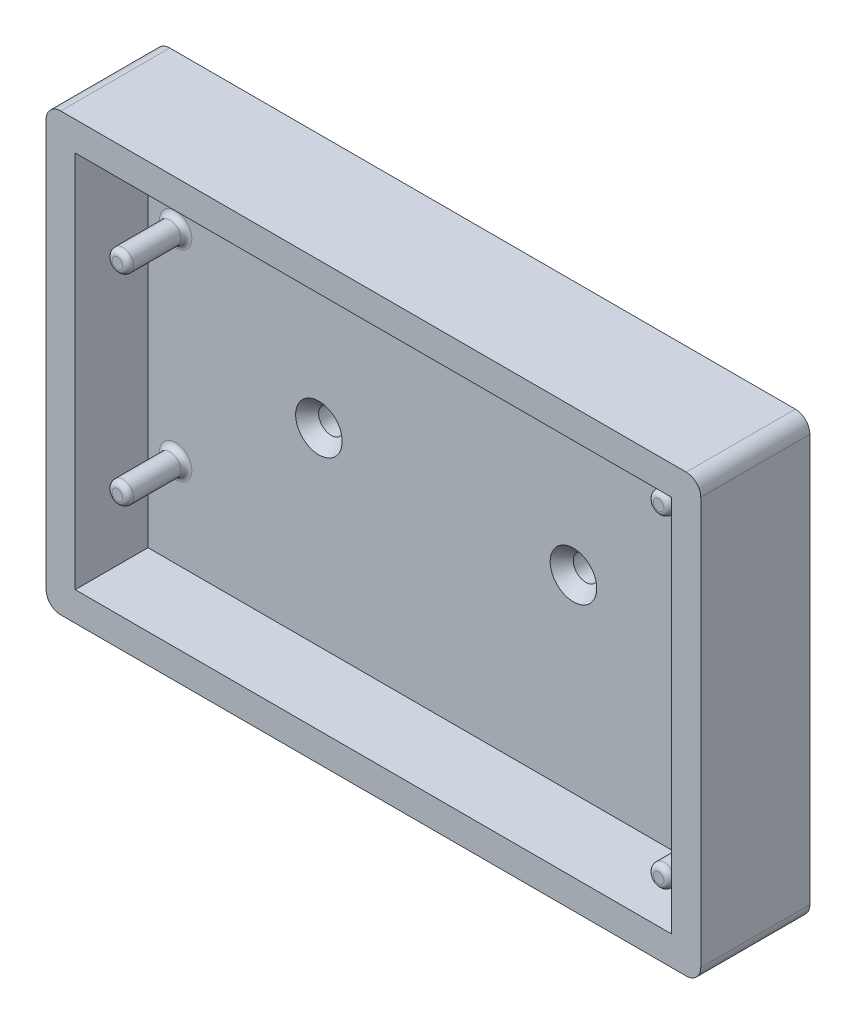
from build123d import *

# Parameters (mm, degrees)
ESQUISSE1_W                                       = 90
ESQUISSE1_H                                       = 60
BOSS_EXTRU_1_DEPTH                                = 5
ESQUISSE2_W                                       = 90
ESQUISSE2_H                                       = 60
ESQUISSE2_W_2                                     = 82
ESQUISSE2_H_2                                     = 52
BOSS_EXTRU_2_DEPTH                                = 10
ESQUISSE3_R                                       = 1.475
BOSS_EXTRU_3_DEPTH                                = 8
FRAISAGE_POUR_VIS_T_TE_FRAIS_E_BOMB_E_D           = 3.4544
FRAISAGE_POUR_VIS_T_TE_FRAIS_E_BOMB_E_CSINK_D     = 6.4008
FRAISAGE_POUR_VIS_T_TE_FRAIS_E_BOMB_E_CSINK_ANGLE = 82
CONG_1_R                                          = 2
CONG_2_R                                          = 0.75


with BuildPart() as part:
    # Esquisse1 → Boss.-Extru.1 (new body)
    with BuildSketch(Plane.XY):
        Rectangle(ESQUISSE1_W, ESQUISSE1_H)
    extrude(amount=BOSS_EXTRU_1_DEPTH)

    # Esquisse2 → Boss.-Extru.2 (add)
    with BuildSketch(Plane.XY.offset(5)):
        Rectangle(ESQUISSE2_W, ESQUISSE2_H)
        Rectangle(ESQUISSE2_W_2, ESQUISSE2_H_2, mode=Mode.SUBTRACT)
    extrude(amount=BOSS_EXTRU_2_DEPTH)

    # Esquisse3 → Boss.-Extru.3 (add)
    with BuildSketch(Plane.XY.offset(5)):
        with Locations(Location((-37.2, 13.800000038, 0), (0, 0, 180))):
            Circle(ESQUISSE3_R)
        with Locations(Location((-37.2, -13.800000038, 0), (0, 0, 180))):
            Circle(ESQUISSE3_R)
        with Locations(Location((37.2, -22.2, 0), (0, 0, 180))):
            Circle(ESQUISSE3_R)
        with Locations(Location((37.2, 22.2, 0), (0, 0, 180))):
            Circle(ESQUISSE3_R)
    extrude(amount=BOSS_EXTRU_3_DEPTH)

    # Fraisage pour vis à tête fraisée bombée #51 (through all)
    with Locations(Plane.XY.offset(5)):
        with Locations((-17.5, 0), (17.5, 0)):
            CounterSinkHole(FRAISAGE_POUR_VIS_T_TE_FRAIS_E_BOMB_E_D / 2, FRAISAGE_POUR_VIS_T_TE_FRAIS_E_BOMB_E_CSINK_D / 2, counter_sink_angle=FRAISAGE_POUR_VIS_T_TE_FRAIS_E_BOMB_E_CSINK_ANGLE)

    # Congé1
    cong_1_edges = [part.edges().sort_by_distance(p)[0] for p in [
        (-45, 30, 7.5),
        (-45, -30, 7.5),
        (45, -30, 7.5),
        (45, 30, 7.5),
    ]]
    fillet(cong_1_edges, radius=CONG_1_R)

    # Congé2
    cong_2_edges = [part.edges().sort_by_distance(p)[0] for p in [
        (-35.725, 13.800000038, 5),
        (-35.725, 13.800000038, 13),
        (-35.725, -13.800000038, 5),
        (-35.725, -13.800000038, 13),
        (38.675, -22.2, 5),
        (38.675, -22.2, 13),
        (38.675, 22.2, 5),
        (38.675, 22.2, 13),
    ]]
    fillet(cong_2_edges, radius=CONG_2_R)


solid = part.part
